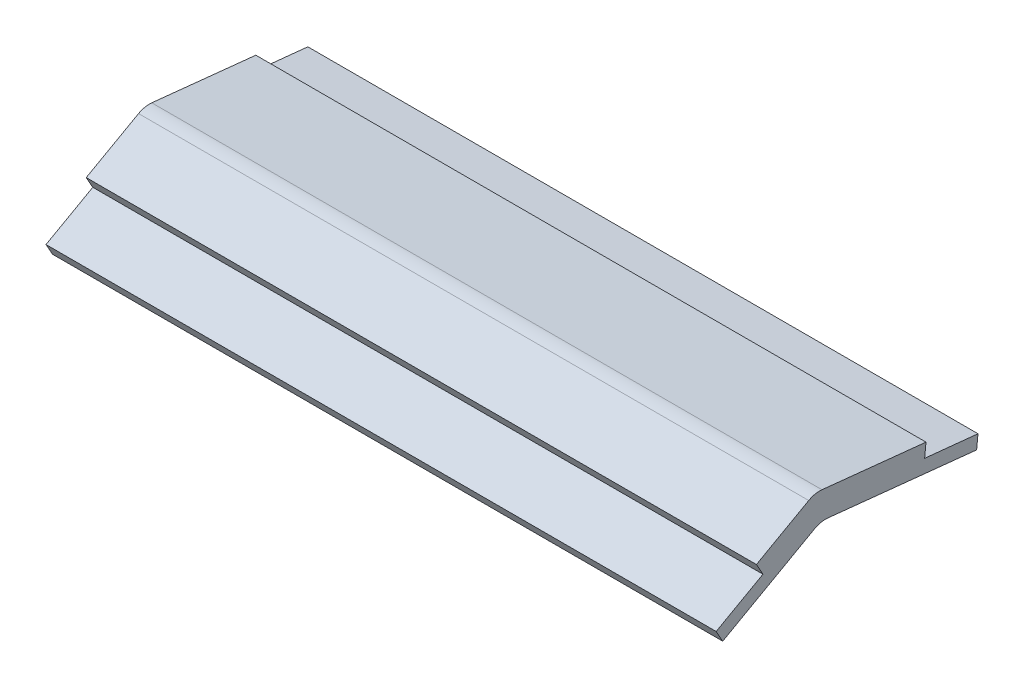
from build123d import *

# Parameters (mm, degrees)
BOSS_EXTRUDE1_DEPTH = 150


with BuildPart() as part:
    # Sketch1 → Boss-Extrude1 (new body)
    with BuildSketch(Plane(origin=(0, 0, 0), x_dir=(0, 0, -1), z_dir=(1, 0, 0))):
        with BuildLine():
            Line((-17.045147988, 11.09483048), (-15.580534174, 8.476642867))
            Line((-15.580534174, 8.476642867), (-26.053284627, 2.618187613))
            Line((-26.053284627, 2.618187613), (-24.588670814, 0))
            Line((-24.588670814, 0), (-4.018503161, 11.506949134))
            ThreePointArc((-4.018503161, 11.506949134), (-2.587030391, 12.04032346), (-1.061322063, 12.116589836))
            Line((-1.061322063, 12.116589836), (32.239586361, 8.66041814))
            Line((32.239586361, 8.66041814), (32.549281207, 11.644390175))
            Line((32.549281207, 11.644390175), (20.610234377, 12.852347461))
            Line((20.610234377, 12.852347461), (20.912223699, 15.837109168))
            Line((20.912223699, 15.837109168), (-2.379077071, 18.254422638))
            ThreePointArc((-2.379077071, 18.254422638), (-3.904785399, 18.178156261), (-5.336258169, 17.644781935))
            Line((-5.336258169, 17.644781935), (-17.045147988, 11.09483048))
        make_face()
    extrude(amount=BOSS_EXTRUDE1_DEPTH)


solid = part.part
